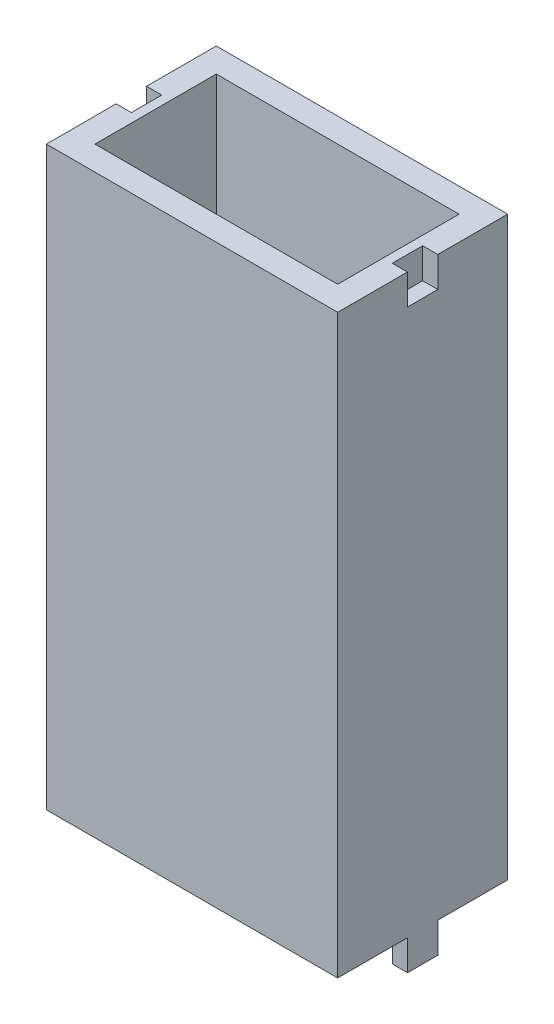
from build123d import *

# Parameters (mm, degrees)
SKETCH1_W           = 48
SKETCH1_H           = 28
SKETCH1_W_2         = 40
SKETCH1_H_2         = 20
BOSS_EXTRUDE1_DEPTH = 95
SKETCH2_W           = 2.5
SKETCH2_H           = 5
CUT_EXTRUDE1_DEPTH  = 5
SKETCH6_W           = 2.5
SKETCH6_H           = 5
BOSS_EXTRUDE3_DEPTH = 5


with BuildPart() as part:
    # Sketch1 → Boss-Extrude1 (new body)
    with BuildSketch(Plane(origin=(0, 0, 0), x_dir=(1, 0, 0), z_dir=(0, 1, 0))):
        with Locations((20, -10)):
            Rectangle(SKETCH1_W, SKETCH1_H)
        with Locations((20, -10)):
            Rectangle(SKETCH1_W_2, SKETCH1_H_2, mode=Mode.SUBTRACT)
    extrude(amount=BOSS_EXTRUDE1_DEPTH)

    # Sketch2 → Cut-Extrude1 (cut)
    with BuildSketch(Plane(origin=(0, 95, 0), x_dir=(1, 0, 0), z_dir=(0, 1, 0))):
        with Locations((-2.75, -10)):
            Rectangle(SKETCH2_W, SKETCH2_H)
        with Locations((42.75, -10)):
            Rectangle(SKETCH2_W, SKETCH2_H)
    extrude(amount=-CUT_EXTRUDE1_DEPTH, mode=Mode.SUBTRACT)

    # Sketch6 → Boss-Extrude3 (add)
    with BuildSketch(Plane.XZ):
        with Locations((-2.75, 10)):
            Rectangle(SKETCH6_W, SKETCH6_H)
        with Locations((42.75, 10)):
            Rectangle(SKETCH6_W, SKETCH6_H)
    extrude(amount=BOSS_EXTRUDE3_DEPTH)


solid = part.part
